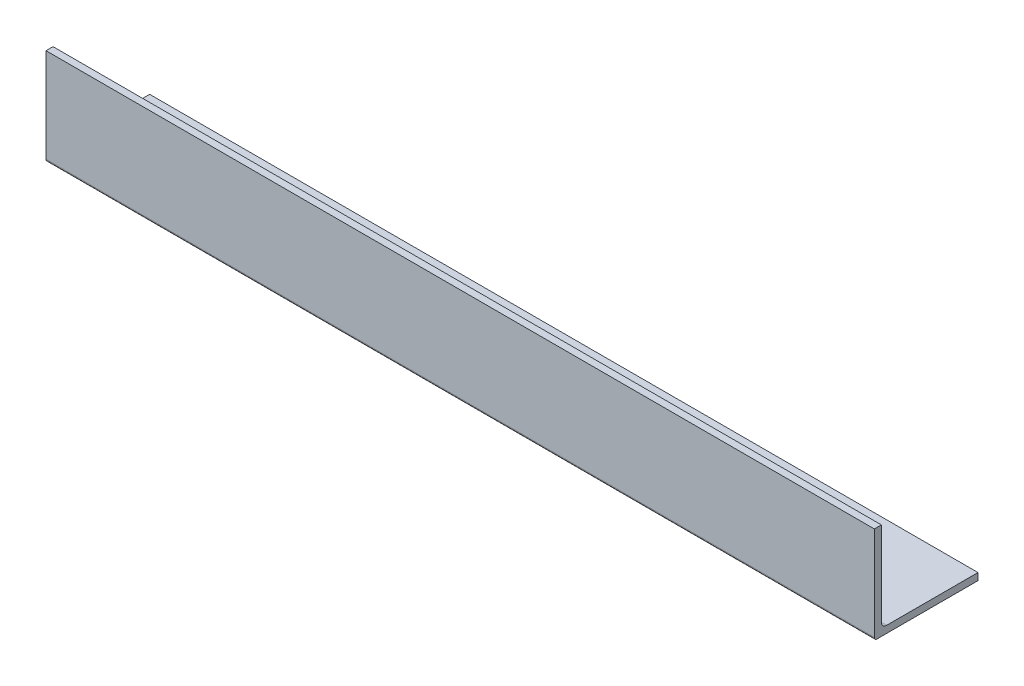
from build123d import *

# Parameters (mm, degrees)
CROQUIS1_W              = 471.25
CROQUIS1_H              = 55
SALIENTE_EXTRUIR1_DEPTH = 4
CROQUIS2_W              = 471.25
CROQUIS2_H              = 4
SALIENTE_EXTRUIR2_DEPTH = 55
REDONDEO1_R             = 3
REDONDEO2_R             = 1.5


with BuildPart() as part:
    # Croquis1 → Saliente-Extruir1 (new body)
    with BuildSketch(Plane.XY):
        Rectangle(CROQUIS1_W, CROQUIS1_H)
    extrude(amount=SALIENTE_EXTRUIR1_DEPTH)

    # Croquis2 → Saliente-Extruir2 (add)
    with BuildSketch(Plane(origin=(0, 0, 0), x_dir=(-1, 0, 0), z_dir=(0, 0, -1))):
        with Locations((0, -25.5)):
            Rectangle(CROQUIS2_W, CROQUIS2_H)
    extrude(amount=SALIENTE_EXTRUIR2_DEPTH)

    # Redondeo1
    redondeo1_edges = [part.edges().sort_by_distance(p)[0] for p in [
        (0, -23.5, 0),
    ]]
    fillet(redondeo1_edges, radius=REDONDEO1_R)

    # Redondeo2
    redondeo2_edges = [part.edges().sort_by_distance(p)[0] for p in [
        (0, -27.5, 4),
    ]]
    fillet(redondeo2_edges, radius=REDONDEO2_R)


solid = part.part
